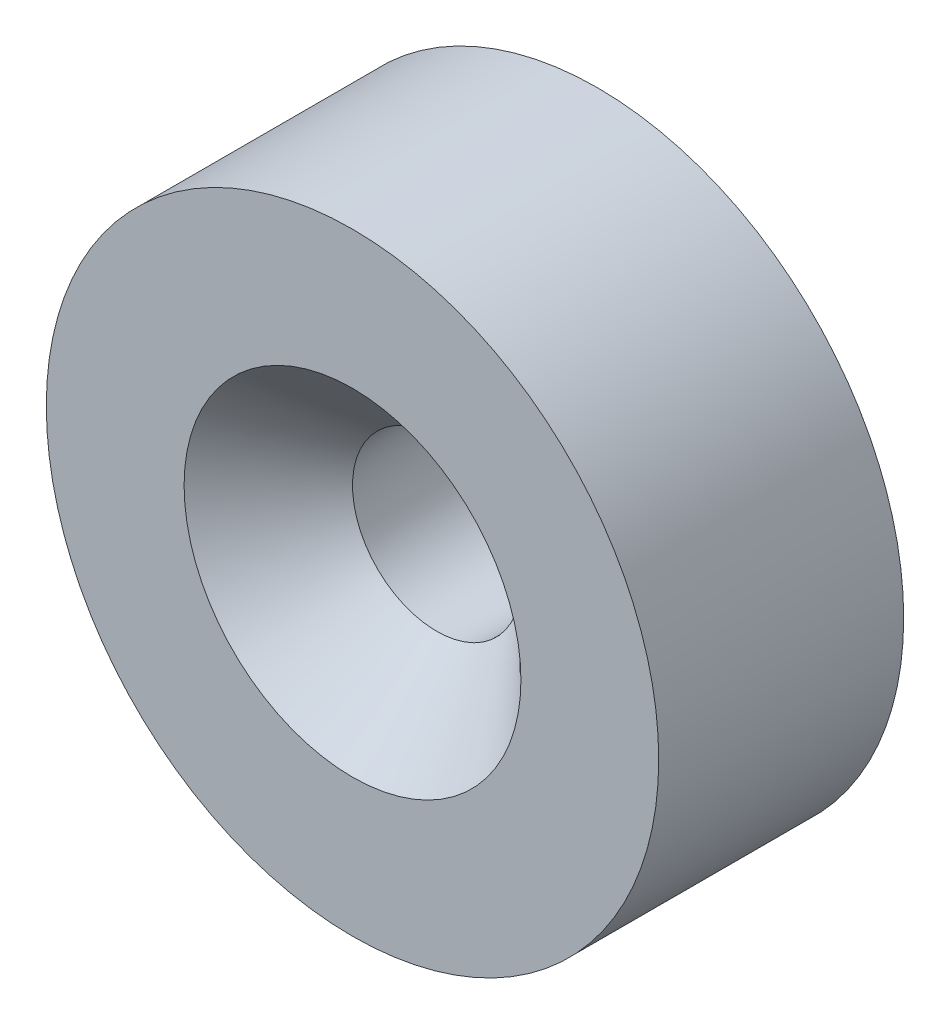
from build123d import *

# Parameters (mm, degrees)
SKETCH_1_R                = 10
EXTRUDE_1_DEPTH           = 8
HOLE_WIZARD_1_D           = 5.5
HOLE_WIZARD_1_DEPTH       = 10.1
HOLE_WIZARD_1_CSINK_D     = 11
HOLE_WIZARD_1_CSINK_ANGLE = 90
HOLE_WIZARD_1_TIP         = 1.652366702


with BuildPart() as part:
    # 草图1 → 凸台-拉伸1 (new body)
    with BuildSketch(Plane.XY):
        Circle(SKETCH_1_R)
    extrude(amount=EXTRUDE_1_DEPTH)

    # 打孔尺寸(%根据)内六角花形沉头螺钉的类型1
    with Locations(Plane.XY.offset(8)):
        with Locations((0, 0)):
            CounterSinkHole(HOLE_WIZARD_1_D / 2, HOLE_WIZARD_1_CSINK_D / 2, depth=HOLE_WIZARD_1_DEPTH, counter_sink_angle=HOLE_WIZARD_1_CSINK_ANGLE)
            with Locations((0, 0, -(HOLE_WIZARD_1_DEPTH + HOLE_WIZARD_1_TIP / 2))):  # 118° drill point
                Cone(0, HOLE_WIZARD_1_D / 2, HOLE_WIZARD_1_TIP, mode=Mode.SUBTRACT)


solid = part.part
